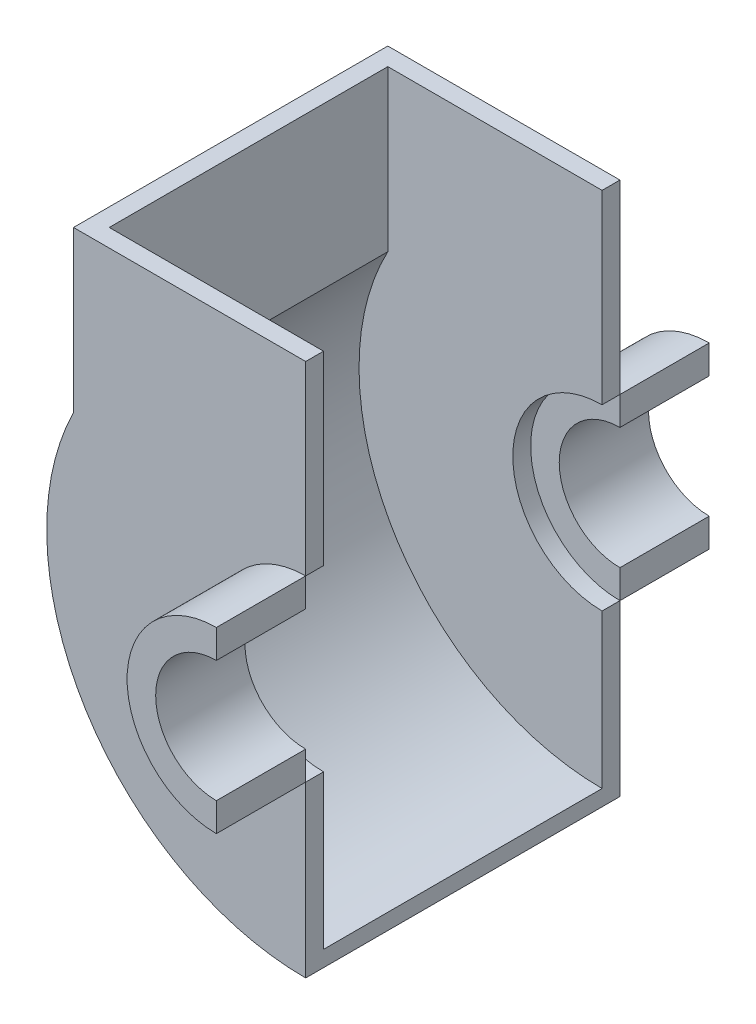
from build123d import *

# Parameters (mm, degrees)
BOSS_EXTRUDE1_DEPTH      = 20
BOSS_EXTRUDE1_DEPTH_BACK = 5
BOSS_EXTRUDE2_DEPTH      = 5
BOSS_EXTRUDE3_DEPTH      = 78


with BuildPart() as part:
    # Sketch1 → Boss-Extrude1 (new, two sides: drawn at the far end of the back side and taken through both)
    with BuildSketch(Plane.XY.offset(-BOSS_EXTRUDE1_DEPTH_BACK)):
        with BuildLine():
            Line((0, 25), (0, 17))
            ThreePointArc((0, 17), (-17, 0), (0, -17))
            Line((0, -17), (0, -25))
            ThreePointArc((0, -25), (-25, 0), (0, 25))
        make_face()
    extrude(amount=BOSS_EXTRUDE1_DEPTH + BOSS_EXTRUDE1_DEPTH_BACK)


with BuildPart() as body_2:
    # Sketch2 → Boss-Extrude2 (new body)
    with BuildSketch(Plane.XY.offset(20)):
        with BuildLine():
            ThreePointArc((-65, 32.113081447), (-61.581037686, -38.262590053), (0, -72.5))
            Line((0, -72.5), (0, -34.821630737))
            Line((0, -34.821630737), (0, -25))
            ThreePointArc((0, -25), (-25, 0), (0, 25))
            Line((0, 25), (0, 77))
            Line((0, 77), (-65, 77))
            Line((-65, 77), (-65, 32.113081447))
        make_face()
    extrude(amount=BOSS_EXTRUDE2_DEPTH)


with BuildPart() as body_3:
    # Mirror5: mirrored copy
    add(body_2.part.mirror(Plane(origin=(0, 0, 64), x_dir=(1, 0, 0), z_dir=(0, 0, -1))))


with BuildPart() as body_4:
    # Mirror5 2: mirrored copy
    add(part.part.mirror(Plane(origin=(0, 0, 64), x_dir=(1, 0, 0), z_dir=(0, 0, -1))))


with BuildPart() as body_2_1:
    add(body_2.part)

    add(body_3.part)  # Boss-Extrude3 merges body 3
    # Sketch6 → Boss-Extrude3 (add)
    with BuildSketch(Plane(origin=(0, 0, 103), x_dir=(-1, 0, 0), z_dir=(0, 0, -1))):
        with BuildLine():
            Line((65, 32.113081447), (65, 77))
            Line((65, 77), (60, 77))
            Line((60, 77), (60, 32.113081447))
            ThreePointArc((60, 32.113081447), (58.380864924, -34.970339014), (0, -68.053287944))
            Line((0, -68.053287944), (0, -72.5))
            ThreePointArc((0, -72.5), (61.581037686, -38.262590053), (65, 32.113081447))
        make_face()
    extrude(amount=BOSS_EXTRUDE3_DEPTH)


solid = Compound([part.part, body_4.part, body_2_1.part])
